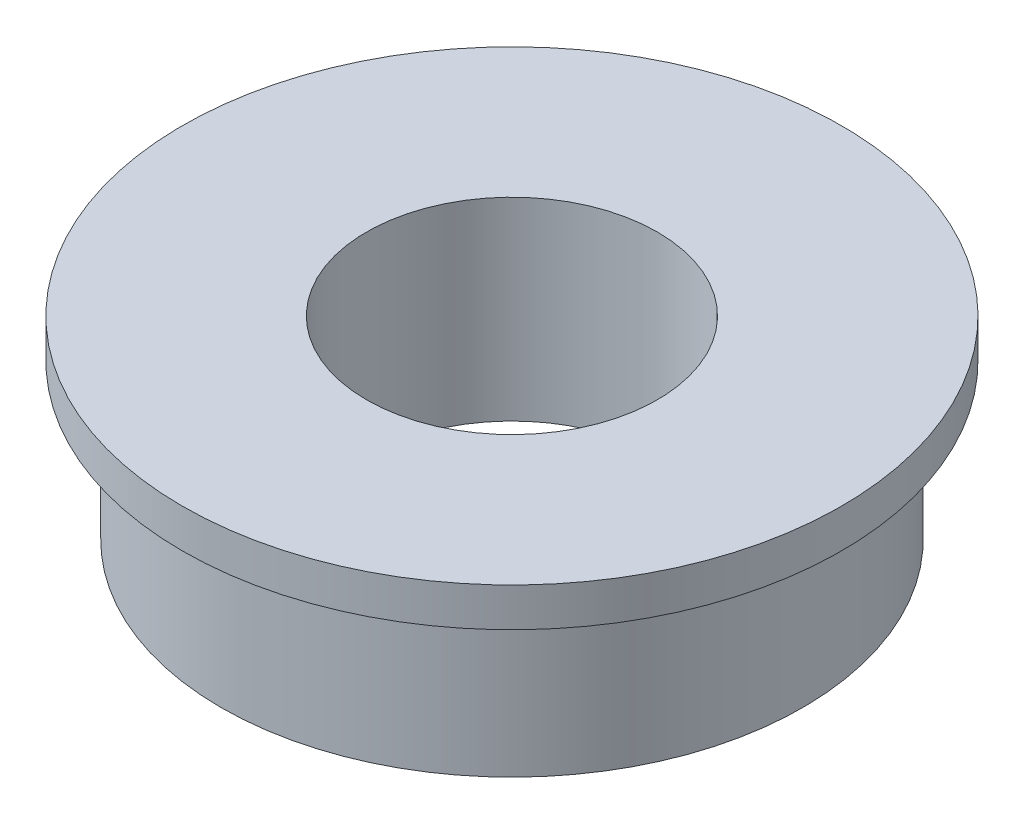
from build123d import *

# Parameters (mm, degrees)
SKETCH_1_R      = 6
SKETCH_1_R_2    = 3
EXTRUDE_1_DEPTH = 3.2
SKETCH_2_R      = 6.8
SKETCH_2_R_2    = 3
EXTRUDE_2_DEPTH = 0.8


with BuildPart() as part:
    # 草图1 → 凸台-拉伸1 (new body)
    with BuildSketch(Plane(origin=(0, 0, 0), x_dir=(1, 0, 0), z_dir=(0, 1, 0))):
        with Locations(Location((0, 0, 0), (0, 0, 270))):
            Circle(SKETCH_1_R)
        with Locations(Location((0, 0, 0), (0, 0, 270))):
            Circle(SKETCH_1_R_2, mode=Mode.SUBTRACT)
    extrude(amount=EXTRUDE_1_DEPTH)

    # 草图2 → 凸台-拉伸2 (add)
    with BuildSketch(Plane(origin=(0, 3.2, 0), x_dir=(1, 0, 0), z_dir=(0, 1, 0))):
        with Locations(Location((0, 0, 0), (0, 0, 270))):
            Circle(SKETCH_2_R)
        with Locations(Location((0, 0, 0), (0, 0, 270))):
            Circle(SKETCH_2_R_2, mode=Mode.SUBTRACT)
    extrude(amount=EXTRUDE_2_DEPTH)


solid = part.part
